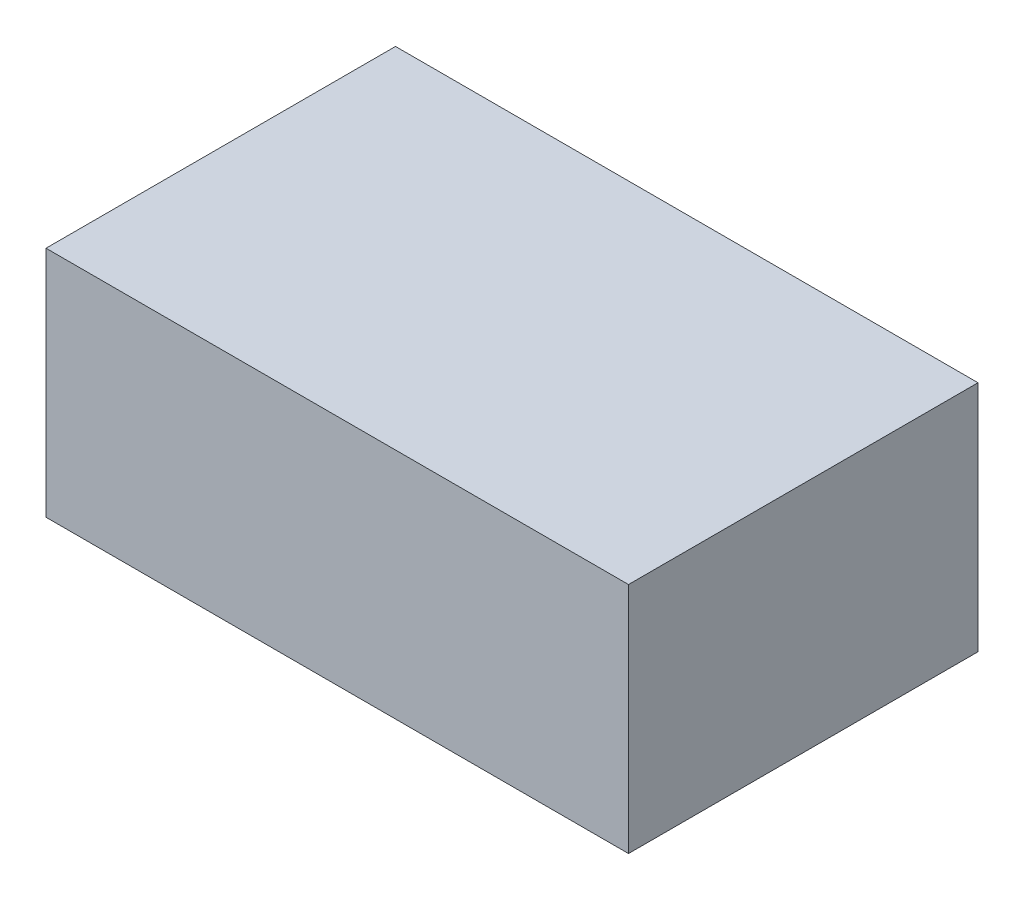
from build123d import *

# Parameters (mm, degrees)
CROQUIS1_W              = 50
CROQUIS1_H              = 30
SALIENTE_EXTRUIR1_DEPTH = 20


with BuildPart() as part:
    # Croquis1 → Saliente-Extruir1 (new body)
    with BuildSketch(Plane(origin=(0, 0, 0), x_dir=(1, 0, 0), z_dir=(0, 1, 0))):
        with Locations((0, 15)):
            Rectangle(CROQUIS1_W, CROQUIS1_H)
    extrude(amount=SALIENTE_EXTRUIR1_DEPTH)


solid = part.part
